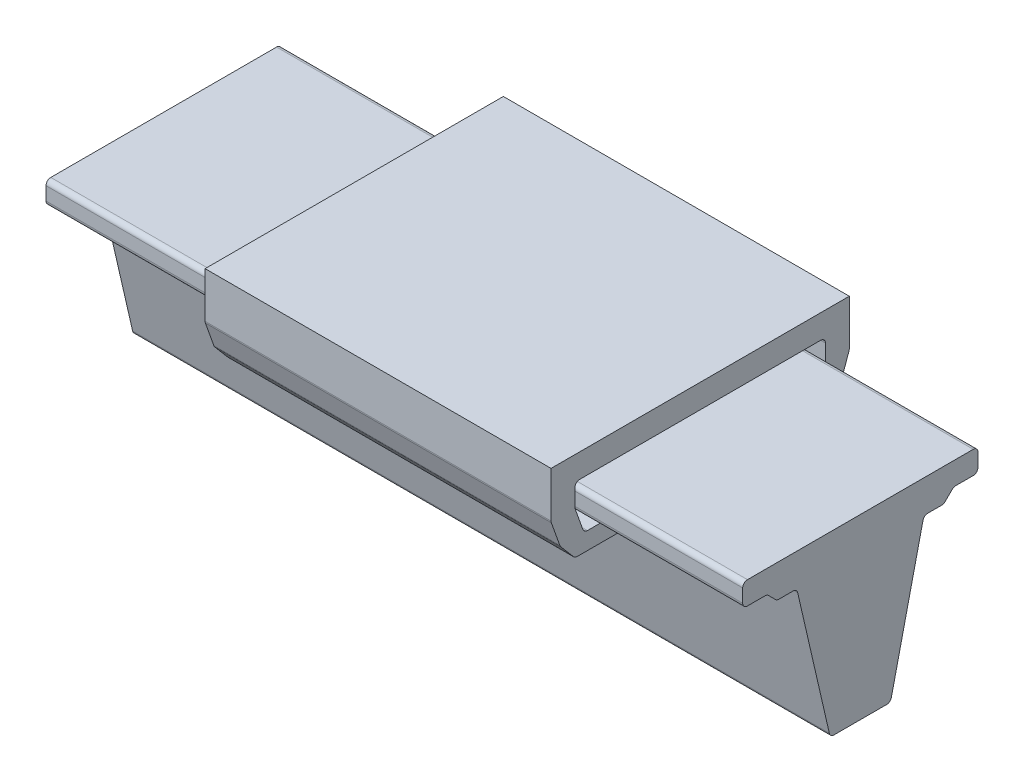
from build123d import *

# Parameters (mm, degrees)
BOSS_EXTRUDE5_DEPTH = 290
BOSS_EXTRUDE6_DEPTH = 133
BOSS_EXTRUDE7_START = 161
BOSS_EXTRUDE7_DEPTH = 161


with BuildPart() as part:
    # Sketch2 → Boss-Extrude5 (new body)
    with BuildSketch(Plane(origin=(0, 0, 0), x_dir=(0, 0, -1), z_dir=(1, 0, 0))):
        with BuildLine():
            Line((47.65128655, -47.647444653), (69.112553011, -47.647444653))
            Line((69.112553011, -47.647444653), (69.112553011, -44.372439073))
            ThreePointArc((69.112553011, -44.372439073), (67.940980136, -41.544011948), (65.112553011, -40.372439073))
            Line((65.112553011, -40.372439073), (47.65128655, -40.372439073))
            Line((47.65128655, -40.372439073), (47.65128655, -47.647444653))
        make_face()
        Polygon((20, -29.183388594), (20, -18.220530088), (20, -10.096437584), (9.907242899, -10.096437584), (9.907242899, -29.183388594), align=None)
        with BuildLine():
            Line((180.891393153, -44.353308741), (180.891393153, -47.628314321))
            Line((180.891393153, -47.628314321), (202.352659615, -47.628314321))
            Line((202.352659615, -47.628314321), (202.352659615, -40.353308741))
            Line((202.352659615, -40.353308741), (184.891393153, -40.353308741))
            ThreePointArc((184.891393153, -40.353308741), (182.062966029, -41.524881617), (180.891393153, -44.353308741))
        make_face()
        Polygon((240.709987292, -11.100699878), (230.003946164, -11.100699878), (230.003946164, -18.201399757), (230.003946164, -29.183388594), (240.709987292, -29.183388594), align=None)
        with BuildLine():
            Line((220.883509716, -10.096437584), (206.116246719, -10.096437584))
            Line((206.116246719, -10.096437584), (206.116246719, -29.183388594))
            Line((206.116246719, -29.183388594), (220.883509716, -29.183388594))
            ThreePointArc((220.883509716, -29.183388594), (223.711936841, -28.011815719), (224.883509716, -25.183388594))
            Line((224.883509716, -25.183388594), (224.883509716, -14.096437584))
            ThreePointArc((224.883509716, -14.096437584), (223.711936841, -11.268010459), (220.883509716, -10.096437584))
        make_face()
        with BuildLine():
            Line((31.637413711, -29.183388594), (46.404676709, -29.183388594))
            Line((46.404676709, -29.183388594), (46.404676709, -10.096437584))
            Line((46.404676709, -10.096437584), (31.637413711, -10.096437584))
            ThreePointArc((31.637413711, -10.096437584), (28.808986587, -11.268010459), (27.637413711, -14.096437584))
            Line((27.637413711, -14.096437584), (27.637413711, -25.183388594))
            ThreePointArc((27.637413711, -25.183388594), (28.808986587, -28.011815719), (31.637413711, -29.183388594))
        make_face()
        with BuildLine():
            ThreePointArc((46.404676709, -29.183388594), (47.935410438, -29.487870464), (49.233103833, -30.35496147))
            Line((49.233103833, -30.35496147), (55.170377581, -36.292235217))
            ThreePointArc((55.170377581, -36.292235217), (56.468070976, -37.159326222), (57.998804705, -37.463808092))
            Line((57.998804705, -37.463808092), (69.823983025, -37.463808092))
            ThreePointArc((69.823983025, -37.463808092), (72.315164546, -38.334269048), (73.722107943, -40.566800779))
            Line((73.722107943, -40.566800779), (100.281918883, -155.987778215))
            ThreePointArc((100.281918883, -155.987778215), (101.688862279, -158.220309946), (104.180043801, -159.090770902))
            Line((104.180043801, -159.090770902), (148.340879626, -159.090770902))
            ThreePointArc((148.340879626, -159.090770902), (150.832061148, -158.220309946), (152.239004545, -155.987778215))
            Line((152.239004545, -155.987778215), (178.798815484, -40.566800779))
            ThreePointArc((178.798815484, -40.566800779), (180.205758881, -38.334269048), (182.696940403, -37.463808092))
            Line((182.696940403, -37.463808092), (194.522118722, -37.463808092))
            ThreePointArc((194.522118722, -37.463808092), (196.052852452, -37.159326222), (197.350545847, -36.292235217))
            Line((197.350545847, -36.292235217), (203.287819594, -30.35496147))
            ThreePointArc((203.287819594, -30.35496147), (204.585512989, -29.487870464), (206.116246719, -29.183388594))
            Line((206.116246719, -29.183388594), (206.116246719, -10.096437584))
            Line((206.116246719, -10.096437584), (46.404676709, -10.096437584))
            Line((46.404676709, -10.096437584), (46.404676709, -29.183388594))
        make_face()
        with BuildLine():
            ThreePointArc((0, -18.220530088), (0.058322558, -18.901102602), (0.231589473, -19.56182875))
            Line((0.231589473, -19.56182875), (7.393090493, -39.682236379))
            ThreePointArc((7.393090493, -39.682236379), (7.696396138, -40.339199), (8.113096085, -40.930769246))
            Line((8.113096085, -40.930769246), (18.801964029, -53.512281762))
            ThreePointArc((18.801964029, -53.512281762), (20.170983082, -54.5528308), (21.850368965, -54.922450233))
            Line((21.850368965, -54.922450233), (47.65128655, -54.922450233))
            Line((47.65128655, -54.922450233), (65.112553011, -54.922450233))
            ThreePointArc((65.112553011, -54.922450233), (67.940980136, -53.750877358), (69.112553011, -50.922450233))
            Line((69.112553011, -50.922450233), (69.112553011, -47.647444653))
            Line((69.112553011, -47.647444653), (47.65128655, -47.647444653))
            Line((47.65128655, -47.647444653), (47.65128655, -40.372439073))
            Line((47.65128655, -40.372439073), (30.460848961, -40.372439073))
            ThreePointArc((30.460848961, -40.372439073), (28.154899552, -39.640863361), (26.692438434, -37.713737735))
            Line((26.692438434, -37.713737735), (20.231589473, -19.56182875))
            ThreePointArc((20.231589473, -19.56182875), (20.058322558, -18.901102602), (20, -18.220530088))
            Line((20, -18.220530088), (20, -29.183388594))
            Line((20, -29.183388594), (9.907242899, -29.183388594))
            Line((9.907242899, -29.183388594), (9.907242899, -10.096437584))
            Line((9.907242899, -10.096437584), (20, -10.096437584))
            Line((20, -10.096437584), (20, -4))
            ThreePointArc((20, -4), (21.171572875, -1.171572875), (24, 0))
            Line((24, 0), (115.13353494, 0))
            Line((115.13353494, 0), (125.001973082, 0))
            Line((125.001973082, 0), (226.003946164, 0))
            ThreePointArc((226.003946164, 0), (228.832373289, -1.171572875), (230.003946164, -4))
            Line((230.003946164, -4), (230.003946164, -11.100699878))
            Line((230.003946164, -11.100699878), (240.709987292, -11.100699878))
            Line((240.709987292, -11.100699878), (240.709987292, -29.183388594))
            Line((240.709987292, -29.183388594), (230.003946164, -29.183388594))
            Line((230.003946164, -29.183388594), (230.003946164, -18.201399757))
            ThreePointArc((230.003946164, -18.201399757), (229.945623606, -18.88197227), (229.772356691, -19.542698419))
            Line((229.772356691, -19.542698419), (223.311507731, -37.694607403))
            ThreePointArc((223.311507731, -37.694607403), (221.849046613, -39.621733029), (219.543097204, -40.353308741))
            Line((219.543097204, -40.353308741), (202.352659615, -40.353308741))
            Line((202.352659615, -40.353308741), (202.352659615, -47.628314321))
            Line((202.352659615, -47.628314321), (180.891393153, -47.628314321))
            Line((180.891393153, -47.628314321), (180.891393153, -50.903319902))
            ThreePointArc((180.891393153, -50.903319902), (182.062966029, -53.731747026), (184.891393153, -54.903319902))
            Line((184.891393153, -54.903319902), (202.352659615, -54.903319902))
            Line((202.352659615, -54.903319902), (228.1535772, -54.903319902))
            ThreePointArc((228.1535772, -54.903319902), (229.832963082, -54.533700468), (231.201982136, -53.493151431))
            Line((231.201982136, -53.493151431), (241.89085008, -40.911638914))
            ThreePointArc((241.89085008, -40.911638914), (242.307550026, -40.320068669), (242.610855671, -39.663106047))
            Line((242.610855671, -39.663106047), (249.772356691, -19.542698419))
            ThreePointArc((249.772356691, -19.542698419), (249.945623606, -18.88197227), (250.003946164, -18.201399757))
            Line((250.003946164, -18.201399757), (250.003946164, 0))
            Line((250.003946164, 0), (250, 0))
            Line((250, 0), (250, 20))
            Line((250, 20), (0, 20))
            Line((0, 20), (0, 0))
            Line((0, 0), (0, -18.220530088))
        make_face()
    extrude(amount=BOSS_EXTRUDE5_DEPTH)

    # Sketch3 → Boss-Extrude6 (add)
    with BuildSketch(Plane(origin=(290, 0, 0), x_dir=(0, 0, -1), z_dir=(1, 0, 0))):
        with BuildLine():
            Line((206.116246719, -29.183388594), (220.883509716, -29.183388594))
            ThreePointArc((220.883509716, -29.183388594), (223.711936841, -28.011815719), (224.883509716, -25.183388594))
            Line((224.883509716, -25.183388594), (224.883509716, -14.096437584))
            ThreePointArc((224.883509716, -14.096437584), (223.711936841, -11.268010459), (220.883509716, -10.096437584))
            Line((220.883509716, -10.096437584), (31.637413711, -10.096437584))
            ThreePointArc((31.637413711, -10.096437584), (28.808986587, -11.268010459), (27.637413711, -14.096437584))
            Line((27.637413711, -14.096437584), (27.637413711, -25.183388594))
            ThreePointArc((27.637413711, -25.183388594), (28.808986587, -28.011815719), (31.637413711, -29.183388594))
            Line((31.637413711, -29.183388594), (46.404676709, -29.183388594))
            ThreePointArc((46.404676709, -29.183388594), (47.935410438, -29.487870464), (49.233103833, -30.35496147))
            Line((49.233103833, -30.35496147), (55.170377581, -36.292235217))
            ThreePointArc((55.170377581, -36.292235217), (56.468070976, -37.159326222), (57.998804705, -37.463808092))
            Line((57.998804705, -37.463808092), (69.823983025, -37.463808092))
            ThreePointArc((69.823983025, -37.463808092), (72.315164546, -38.334269048), (73.722107943, -40.566800779))
            Line((73.722107943, -40.566800779), (100.281918883, -155.987778215))
            ThreePointArc((100.281918883, -155.987778215), (101.688862279, -158.220309946), (104.180043801, -159.090770902))
            Line((104.180043801, -159.090770902), (148.340879626, -159.090770902))
            ThreePointArc((148.340879626, -159.090770902), (150.832061148, -158.220309946), (152.239004545, -155.987778215))
            Line((152.239004545, -155.987778215), (178.798815484, -40.566800779))
            ThreePointArc((178.798815484, -40.566800779), (180.205758881, -38.334269048), (182.696940403, -37.463808092))
            Line((182.696940403, -37.463808092), (194.522118722, -37.463808092))
            ThreePointArc((194.522118722, -37.463808092), (196.052852452, -37.159326222), (197.350545847, -36.292235217))
            Line((197.350545847, -36.292235217), (203.287819594, -30.35496147))
            ThreePointArc((203.287819594, -30.35496147), (204.585512989, -29.487870464), (206.116246719, -29.183388594))
        make_face()
    extrude(amount=BOSS_EXTRUDE6_DEPTH)

    # Sketch4 → Boss-Extrude7 (add)
    with BuildSketch(Plane.ZY.offset(BOSS_EXTRUDE7_START)):
        with BuildLine():
            Line((-220.883509716, -29.183388594), (-206.116246719, -29.183388594))
            ThreePointArc((-206.116246719, -29.183388594), (-204.585512989, -29.487870464), (-203.287819594, -30.35496147))
            Line((-203.287819594, -30.35496147), (-197.350545847, -36.292235217))
            ThreePointArc((-197.350545847, -36.292235217), (-196.052852452, -37.159326222), (-194.522118722, -37.463808092))
            Line((-194.522118722, -37.463808092), (-182.696940403, -37.463808092))
            ThreePointArc((-182.696940403, -37.463808092), (-180.205758881, -38.334269048), (-178.798815484, -40.566800779))
            Line((-178.798815484, -40.566800779), (-152.239004545, -155.987778215))
            ThreePointArc((-152.239004545, -155.987778215), (-150.832061148, -158.220309946), (-148.340879626, -159.090770902))
            Line((-148.340879626, -159.090770902), (-104.180043801, -159.090770902))
            ThreePointArc((-104.180043801, -159.090770902), (-101.688862279, -158.220309946), (-100.281918883, -155.987778215))
            Line((-100.281918883, -155.987778215), (-73.722107943, -40.566800779))
            ThreePointArc((-73.722107943, -40.566800779), (-72.315164546, -38.334269048), (-69.823983025, -37.463808092))
            Line((-69.823983025, -37.463808092), (-57.998804705, -37.463808092))
            ThreePointArc((-57.998804705, -37.463808092), (-56.468070976, -37.159326222), (-55.170377581, -36.292235217))
            Line((-55.170377581, -36.292235217), (-49.233103833, -30.35496147))
            ThreePointArc((-49.233103833, -30.35496147), (-47.935410438, -29.487870464), (-46.404676709, -29.183388594))
            Line((-46.404676709, -29.183388594), (-31.637413711, -29.183388594))
            ThreePointArc((-31.637413711, -29.183388594), (-28.808986587, -28.011815719), (-27.637413711, -25.183388594))
            Line((-27.637413711, -25.183388594), (-27.637413711, -14.096437584))
            ThreePointArc((-27.637413711, -14.096437584), (-28.808986587, -11.268010459), (-31.637413711, -10.096437584))
            Line((-31.637413711, -10.096437584), (-220.883509716, -10.096437584))
            ThreePointArc((-220.883509716, -10.096437584), (-223.711936841, -11.268010459), (-224.883509716, -14.096437584))
            Line((-224.883509716, -14.096437584), (-224.883509716, -25.183388594))
            ThreePointArc((-224.883509716, -25.183388594), (-223.711936841, -28.011815719), (-220.883509716, -29.183388594))
        make_face()
    extrude(amount=-BOSS_EXTRUDE7_DEPTH)


solid = part.part
